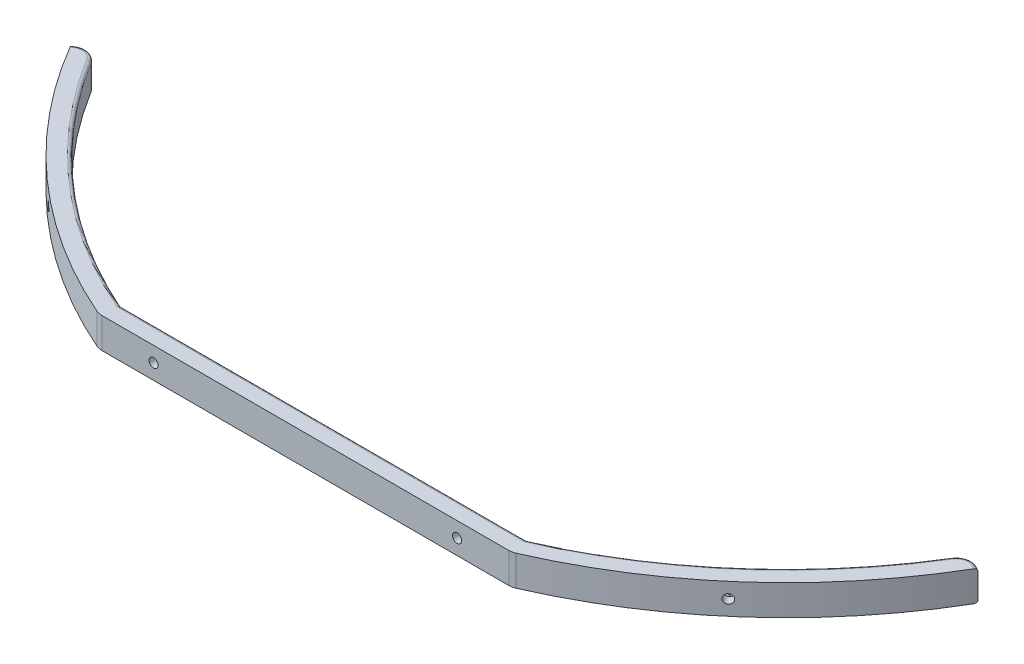
from build123d import *

# Parameters (mm, degrees)
BOSS_EXTRU_1_DEPTH       = 5
BOSS_EXTRU_1_DEPTH_BACK  = 5
ENL_V_MAT_EXTRU_10_DEPTH = 231.054341407
ENL_V_MAT_EXTRU_11_DEPTH = 228.935297837
CONG_1_R                 = 5
ESQUISSE16_R             = 1.5
ENL_V_MAT_EXTRU_13_DEPTH = 218.86334593
ESQUISSE17_R             = 1.5
ENL_V_MAT_EXTRU_14_DEPTH = 122.257222097
ENL_V_START              = -3
ENL_V_MAT_EXTRU_15_DEPTH = 119.257222101
ENL_V_MAT_EXTRU_16_DEPTH = 164.547347768
CONG_2_R                 = 1


with BuildPart() as part:
    # Esquisse1 → Boss.-Extru.1 (new, two sides: drawn at the far end of the back side and taken through both)
    with BuildSketch(Plane(origin=(0, 0, 0), x_dir=(1, 0, 0), z_dir=(0, 1, 0)).offset(-BOSS_EXTRU_1_DEPTH_BACK)):
        with BuildLine():
            Line((0, 49), (165, 49))
            Line((165, 49), (165, -55.235857919))
            ThreePointArc((165, -55.235857919), (127.908511428, -117.963607542), (68.381283989, -160))
            Line((68.381283989, -160), (0, -160))
            Line((0, -160), (0, 49))
        make_face()
    extrude(amount=BOSS_EXTRU_1_DEPTH + BOSS_EXTRU_1_DEPTH_BACK)

    # Symétrie1: part across plane


with BuildPart() as part_1:
    add(part.part)
    add(part.part.mirror(Plane(origin=(0, -5, -49), x_dir=(0, 0, 1), z_dir=(-1, 0, 0))))

    # Esquisse12 → Enlèv. mat.-Extru.10 (cut, through all)
    with BuildSketch(Plane(origin=(0, 5, 0), x_dir=(1, 0, 0), z_dir=(0, 1, 0))):
        with BuildLine():
            Line((165, 49), (-165, 49))
            Line((-165, 49), (-165, -55.235857919))
            ThreePointArc((-165, -55.235857919), (-127.908511428, -117.963607542), (-68.381283989, -160))
            Line((-68.381283989, -160), (68.381283989, -160))
            ThreePointArc((68.381283989, -160), (127.908511428, -117.963607542), (165, -55.235857919))
            Line((165, -55.235857919), (165, 49))
        make_face()
        with BuildLine():
            Line((163.5, 47.5), (-163.5, 47.5))
            Line((-163.5, 47.5), (-163.5, -54.990908339))
            ThreePointArc((-163.5, -54.990908339), (-126.827060587, -116.923678966), (-68.0734897, -158.5))
            Line((-68.0734897, -158.5), (68.0734897, -158.5))
            ThreePointArc((68.0734897, -158.5), (126.827060587, -116.923678966), (163.5, -54.990908339))
            Line((163.5, -54.990908339), (163.5, 47.5))
        make_face(mode=Mode.SUBTRACT)
    extrude(amount=-ENL_V_MAT_EXTRU_10_DEPTH, mode=Mode.SUBTRACT)

    # Esquisse13 → Enlèv. mat.-Extru.11 (cut, through all)
    with BuildSketch(Plane(origin=(0, 5, 0), x_dir=(1, 0, 0), z_dir=(0, 1, 0))):
        with BuildLine():
            Line((-163.5, 47.5), (163.5, 47.5))
            Line((163.5, 47.5), (163.5, -158.5))
            Line((163.5, -158.5), (0, -158.5))
            Line((0, -158.5), (0, -152.5))
            Line((0, -152.5), (-66.828137786, -152.5))
            ThreePointArc((-66.828137786, -152.5), (-111.046814507, -124.059884684), (-144.19322973, -83.25))
            Line((-144.19322973, -83.25), (-163.5, -94.396769013))
            Line((-163.5, -94.396769013), (-163.5, 47.5))
        make_face()
    extrude(amount=-ENL_V_MAT_EXTRU_11_DEPTH, mode=Mode.SUBTRACT)

    # Congé1
    cong_1_edges = [part_1.edges().sort_by_distance(p)[0] for p in [
        (-68.0734897, 0, 158.5),
        (-144.19322973, 0, 83.25),
    ]]
    fillet(cong_1_edges, radius=CONG_1_R)

    # Esquisse16 → Enlèv. mat.-Extru.13 (cut, through all)
    with BuildSketch(Plane.XY):
        with Locations((-50, 0)):
            Circle(ESQUISSE16_R)
    extrude(amount=ENL_V_MAT_EXTRU_13_DEPTH, mode=Mode.SUBTRACT)

    # Esquisse17 → Enlèv. mat.-Extru.14 (cut, through all)
    with BuildSketch(Plane(origin=(-112.029788337, 0, 131.170029066), x_dir=(0, 1, 0), z_dir=(-0.6494480483301822, 0, 0.7604059656000322))):
        Circle(ESQUISSE17_R)
    extrude(amount=-ENL_V_MAT_EXTRU_14_DEPTH, mode=Mode.SUBTRACT)

    # Esquisse18 → Enlèv. mat.-Extru.15 (cut, through all)
    with BuildSketch(Plane(origin=(-112.029788337, 0, 131.170029066), x_dir=(0, 1, 0), z_dir=(-0.6494480483301822, 0, 0.7604059656000322)).offset(ENL_V_START)):
        Polygon((3.175426481, 0), (1.58771324, 2.75), (-1.58771324, 2.75), (-3.175426481, 0), (-1.58771324, -2.75), (1.58771324, -2.75), align=None)
    extrude(amount=-ENL_V_MAT_EXTRU_15_DEPTH, mode=Mode.SUBTRACT)

    # Esquisse19 → Enlèv. mat.-Extru.16 (cut, through all)
    with BuildSketch(Plane.XY.offset(158.5).offset(ENL_V_START)):
        Polygon((-47.25, -1.58771324), (-47.25, 1.58771324), (-50, 3.175426481), (-52.75, 1.58771324), (-52.75, -1.58771324), (-50, -3.175426481), align=None)
    extrude(amount=-ENL_V_MAT_EXTRU_16_DEPTH, mode=Mode.SUBTRACT)

    # Congé2
    cong_2_edges = [part_1.edges().sort_by_distance(p)[0] for p in [
        (-109.226367496, -5, 125.665630319),
        (-144.736674491, -5, 85.195693901),
        (-109.226367496, 5, 125.665630319),
        (-144.736674491, 5, 85.195693901),
        (-148.924802049, -5, 85.981774552),
        (-148.924802049, 5, 85.981774552),
        (-33.414068893, -5, 152.5),
        (-33.414068893, 5, 152.5),
    ]]
    fillet(cong_2_edges, radius=CONG_2_R)

    # Symétrie2: part across plane


with BuildPart() as part_2:
    add(part_1.part)
    add(part_1.part.mirror(Plane(origin=(0, -5, 152.5), x_dir=(0, 0, 1), z_dir=(-1, 0, 0))))


solid = part_2.part
